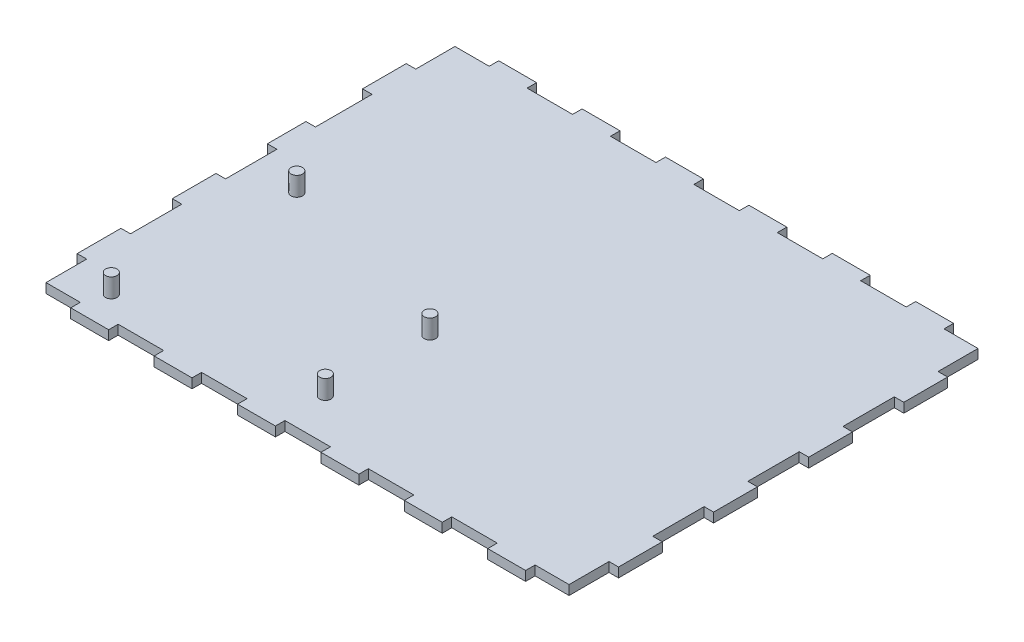
from build123d import *

# Parameters (mm, degrees)
SKETCH1_W           = 144.78
SKETCH1_H           = 114.3
BOSS_EXTRUDE1_DEPTH = 63.5
SKETCH2_W           = 144.78
SKETCH2_H           = 114.3
CUT_EXTRUDE1_DEPTH  = 60.96
SKETCH3_R           = 1.524
BOSS_EXTRUDE2_DEPTH = 5.08
SKETCH4_OUTSIDE_W   = 183.704
SKETCH4_OUTSIDE_H   = 153.224
CUT_EXTRUDE2_DEPTH  = 2.54
SKETCH6_OUTSIDE_W   = 183.704
SKETCH6_OUTSIDE_H   = 153.224
CUT_EXTRUDE4_DEPTH  = 2.54


with BuildPart() as part:
    # Sketch1 → Boss-Extrude1 (new body)
    with BuildSketch(Plane(origin=(0, 0, 0), x_dir=(1, 0, 0), z_dir=(0, 1, 0))):
        Rectangle(SKETCH1_W, SKETCH1_H)
    extrude(amount=BOSS_EXTRUDE1_DEPTH)

    # Sketch2 → Cut-Extrude1 (cut)
    with BuildSketch(Plane(origin=(0, 63.5, 0), x_dir=(1, 0, 0), z_dir=(0, 1, 0))):
        Rectangle(SKETCH2_W, SKETCH2_H)
    extrude(amount=-CUT_EXTRUDE1_DEPTH, mode=Mode.SUBTRACT)

    # Sketch3 → Boss-Extrude2 (add)
    with BuildSketch(Plane(origin=(0, 2.54, 0), x_dir=(1, 0, 0), z_dir=(0, 1, 0))):
        with Locations(Location((-58.42, -48.585184876, 0), (0, 0, 270))):
            Circle(SKETCH3_R)
        with Locations(Location((-6.35, -43.505184876, 0), (0, 0, 270))):
            Circle(SKETCH3_R)
        with Locations(Location((-6.35, -15.565184876, 0), (0, 0, 270))):
            Circle(SKETCH3_R)
        with Locations(Location((-57.15, -0.325184876, 0), (0, 0, 270))):
            Circle(SKETCH3_R)
    extrude(amount=BOSS_EXTRUDE2_DEPTH)

    # Sketch4 outside → Cut-Extrude2 (cut)
    with BuildSketch(Plane(origin=(0, 2.54, 0), x_dir=(1, 0, 0), z_dir=(0, 1, 0))):
        Rectangle(SKETCH4_OUTSIDE_W, SKETCH4_OUTSIDE_H)
        Polygon((69.85, 54.61), (61.296876225, 54.61), (61.296876225, 57.15), (50.159953148, 57.15), (50.159953148, 54.61), (39.023030071, 54.61), (39.023030071, 57.15), (27.886106994, 57.15), (27.886106994, 54.61), (16.749183917, 54.61), (16.749183917, 57.15), (5.61226084, 57.15), (5.61226084, 54.61), (-5.524662236, 54.61), (-5.524662236, 57.15), (-16.661585313, 57.15), (-16.661585313, 54.61), (-27.79850839, 54.61), (-27.79850839, 57.15), (-38.935431467, 57.15), (-38.935431467, 54.61), (-50.072354544, 54.61), (-50.072354544, 57.15), (-61.209277621, 57.15), (-61.209277621, 54.61), (-69.85, 54.61), (-69.85, 44.653580836), (-72.39, 44.653580836), (-72.39, 31.953580836), (-69.85, 31.953580836), (-69.85, 19.253580836), (-72.39, 19.253580836), (-72.39, 6.553580836), (-69.85, 6.553580836), (-69.85, -6.146419164), (-72.39, -6.146419164), (-72.39, -18.846419164), (-69.85, -18.846419164), (-69.85, -31.546419164), (-72.39, -31.546419164), (-72.39, -44.246419164), (-69.85, -44.246419164), (-69.85, -54.61), (-61.209277621, -54.61), (-61.209277621, -57.15), (-50.072354544, -57.15), (-50.072354544, -54.61), (-38.935431467, -54.61), (-38.935431467, -57.15), (-27.79850839, -57.15), (-27.79850839, -54.61), (-16.661585313, -54.61), (-16.661585313, -57.15), (-5.524662236, -57.15), (-5.524662236, -54.61), (5.61226084, -54.61), (5.61226084, -57.15), (16.749183917, -57.15), (16.749183917, -54.61), (27.886106994, -54.61), (27.886106994, -57.15), (39.023030071, -57.15), (39.023030071, -54.61), (50.159953148, -54.61), (50.159953148, -57.15), (61.296876225, -57.15), (61.296876225, -54.61), (69.85, -54.61), (69.85, -44.45), (72.39, -44.45), (72.39, -31.75), (69.85, -31.75), (69.85, -19.05), (72.39, -19.05), (72.39, -6.35), (69.85, -6.35), (69.85, 6.35), (72.39, 6.35), (72.39, 19.05), (69.85, 19.05), (69.85, 31.75), (72.39, 31.75), (72.39, 44.45), (69.85, 44.45), align=None, mode=Mode.SUBTRACT)
    extrude(amount=-CUT_EXTRUDE2_DEPTH, mode=Mode.SUBTRACT)

    # Sketch6 outside → Cut-Extrude4 (cut)
    with BuildSketch(Plane(origin=(0, 2.54, 0), x_dir=(1, 0, 0), z_dir=(0, 1, 0))):
        Rectangle(SKETCH6_OUTSIDE_W, SKETCH6_OUTSIDE_H)
        Polygon((-69.85, 54.61), (-60.701277621, 54.61), (-60.701277621, 57.15), (-50.580354544, 57.15), (-50.580354544, 54.61), (-38.427431467, 54.61), (-38.427431467, 57.15), (-28.30650839, 57.15), (-28.30650839, 54.61), (-16.153585313, 54.61), (-16.153585313, 57.15), (-6.032662236, 57.15), (-6.032662236, 54.61), (6.12026084, 54.61), (6.12026084, 57.15), (16.241183917, 57.15), (16.241183917, 54.61), (28.394106994, 54.61), (28.394106994, 57.15), (38.515030071, 57.15), (38.515030071, 54.61), (50.667953148, 54.61), (50.667953148, 57.15), (60.788876225, 57.15), (60.788876225, 54.61), (69.85, 54.61), (69.85, 43.942), (72.39, 43.942), (72.39, 32.258), (69.85, 32.258), (69.85, 18.542), (72.39, 18.542), (72.39, 6.858), (69.85, 6.858), (69.85, -6.858), (72.39, -6.858), (72.39, -18.542), (69.85, -18.542), (69.85, -32.258), (72.39, -32.258), (72.39, -43.942), (69.85, -43.942), (69.85, -54.61), (60.788876225, -54.61), (60.788876225, -57.15), (50.667953148, -57.15), (50.667953148, -54.61), (38.515030071, -54.61), (38.515030071, -57.15), (28.394106994, -57.15), (28.394106994, -54.61), (16.241183917, -54.61), (16.241183917, -57.15), (6.12026084, -57.15), (6.12026084, -54.61), (-6.032662236, -54.61), (-6.032662236, -57.15), (-16.153585313, -57.15), (-16.153585313, -54.61), (-28.30650839, -54.61), (-28.30650839, -57.15), (-38.427431467, -57.15), (-38.427431467, -54.61), (-50.580354544, -54.61), (-50.580354544, -57.15), (-60.701277621, -57.15), (-60.701277621, -54.61), (-69.85, -54.61), (-69.85, -43.738419164), (-72.39, -43.738419164), (-72.39, -32.054419164), (-69.85, -32.054419164), (-69.85, -18.338419164), (-72.39, -18.338419164), (-72.39, -6.654419164), (-69.85, -6.654419164), (-69.85, 7.061580836), (-72.39, 7.061580836), (-72.39, 17.357767978), (-69.85, 17.357767978), (-69.85, 32.461580836), (-72.39, 32.461580836), (-72.39, 44.145580836), (-69.85, 44.145580836), align=None, mode=Mode.SUBTRACT)
    extrude(amount=-CUT_EXTRUDE4_DEPTH, mode=Mode.SUBTRACT)


solid = part.part
